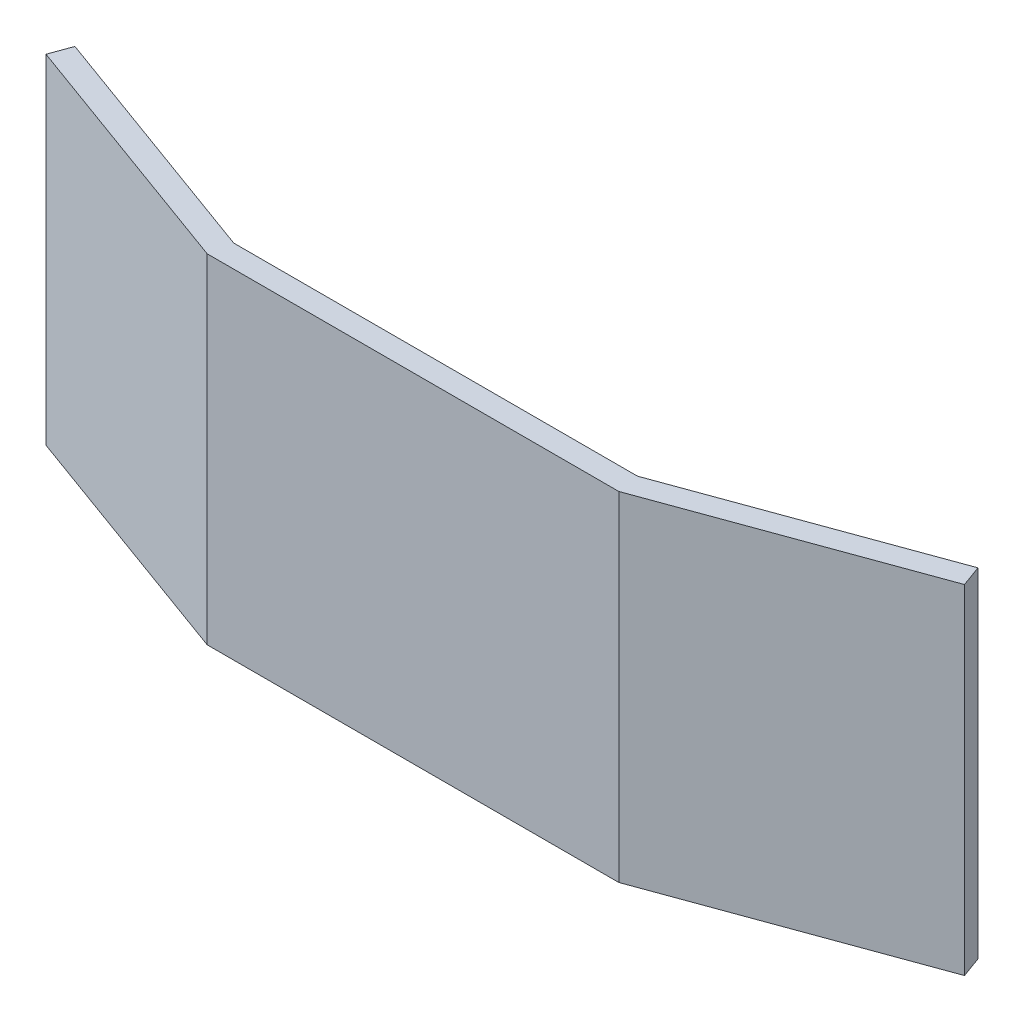
from build123d import *

# Parameters (mm, degrees)
BOSS_EXTRUDE1_DEPTH = 30


with BuildPart() as part:
    # Sketch5 → Boss-Extrude1 (new body)
    with BuildSketch(Plane(origin=(0, 0, 0), x_dir=(1, 0, 0), z_dir=(0, 1, 0))):
        Polygon((-40.684040287, 8.171489044), (-18.233058655, 0), (18.233058655, 0), (40.684040287, 8.171489044), (40, 10.050874286), (17.880404694, 2), (-17.880404694, 2), (-40, 10.050874286), align=None)
    extrude(amount=BOSS_EXTRUDE1_DEPTH)


solid = part.part
